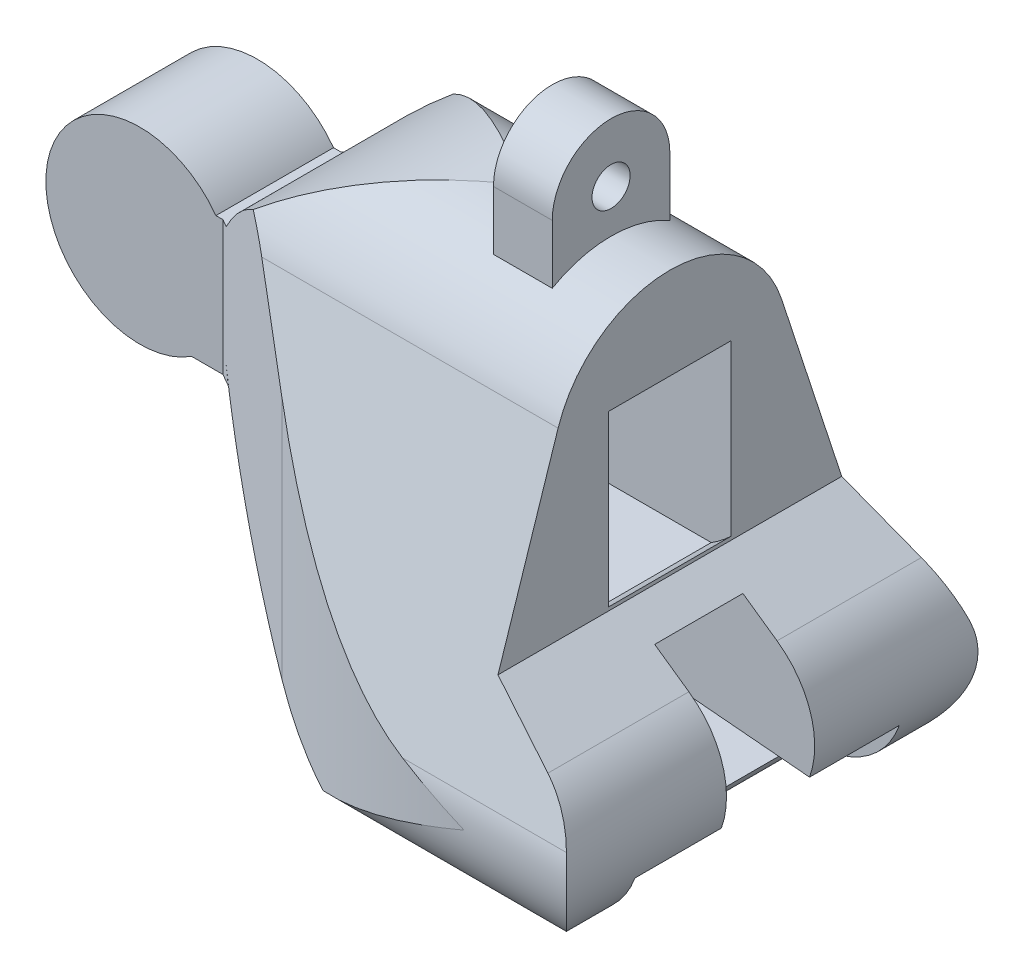
from build123d import *

# Parameters (mm, degrees)
BOSS_EXTRUDE1_DEPTH      = 6.35
BOSS_EXTRUDE2_START      = -7.9375
BOSS_EXTRUDE2_DEPTH      = 22.225
CUT_EXTRUDE1_DEPTH       = 51.557144521
CUT_EXTRUDE2_START       = -7.9375
CUT_EXTRUDE2_DEPTH       = 25.24
CUT_EXTRUDE7_DEPTH       = 10
CUT_EXTRUDE7_DEPTH_BACK  = 19.05
CUT_EXTRUDE10_DEPTH      = 10.16
CUT_EXTRUDE10_DEPTH_BACK = 17.78
CUT_EXTRUDE8_START       = 0.127
CUT_EXTRUDE8_DEPTH       = 6.604
BOSS_EXTRUDE3_START      = -3.175
BOSS_EXTRUDE3_DEPTH      = 3.175
SKETCH14_W               = 1.0287
SKETCH14_H               = 3.176
SKETCH15_W               = 4.7625
SKETCH15_H               = 4.7625
CUT_EXTRUDE15_DEPTH      = 8.703074479
CUT_EXTRUDE16_START      = -3.175
SKETCH16_W               = 4.7625
SKETCH16_H               = 4.7625
CUT_EXTRUDE16_DEPTH      = 32.52405251
SKETCH18_W               = 1.0287
SKETCH18_H               = 3.176
CUT_EXTRUDE17_DEPTH      = 4.7625
BOSS_EXTRUDE5_REACH      = 39.621
BOSS_EXTRUDE6_DEPTH      = 6.35
BOSS_EXTRUDE8_REACH      = 39.621
CUT_EXTRUDE19_DEPTH      = 10.31875
CUT_EXTRUDE19_DEPTH_BACK = 3.96875


with BuildPart() as part:
    # Sketch2 → Boss-Extrude1 (new body)
    with BuildSketch(Plane.XY):
        with BuildLine():
            Line((4.487320853, -2.38125), (4.487320853, 2.38125))
            ThreePointArc((4.487320853, 2.38125), (-5.08, 0), (4.487320853, -2.38125))
        make_face()
    extrude(amount=BOSS_EXTRUDE1_DEPTH)


with BuildPart() as body_2:
    # Sketch3 → Boss-Extrude2 (new body)
    with BuildSketch(Plane.XY.offset(BOSS_EXTRUDE2_START)):
        Polygon((4.487320853, 9.525), (25.442320853, 9.525), (25.442320853, -4.7625), (41.312615578, -15.875), (25.442320853, -15.875), (4.487320853, -15.875), align=None)
    extrude(amount=BOSS_EXTRUDE2_DEPTH)

    # Sketch4 → Cut-Extrude1 (cut, through all)
    with BuildSketch(Plane(origin=(0, 9.525, 0), x_dir=(1, 0, 0), z_dir=(0, 1, 0))):
        with BuildLine():
            Line((4.487320853, -6.35), (11.994161802, -10.684076643))
            ThreePointArc((11.994161802, -10.684076643), (18.481041485, -13.371030185), (25.442320853, -14.2875))
            Line((25.442320853, -14.2875), (4.487320853, -14.2875))
            Line((4.487320853, -14.2875), (4.487320853, -6.35))
        make_face()
        with BuildLine():
            Line((4.487320853, 0), (11.994161802, 4.334076643))
            ThreePointArc((11.994161802, 4.334076643), (18.481041485, 7.021030185), (25.442320853, 7.9375))
            Line((25.442320853, 7.9375), (4.487320853, 7.9375))
            Line((4.487320853, 7.9375), (4.487320853, 0))
        make_face()
    extrude(amount=-CUT_EXTRUDE1_DEPTH, mode=Mode.SUBTRACT)

    # Sketch5 → Cut-Extrude2 (cut)
    with BuildSketch(Plane.XY.offset(CUT_EXTRUDE2_START)):
        with BuildLine():
            Line((4.487320853, -15.875), (4.487320853, -2.38125))
            Line((4.487320853, -2.38125), (4.836453379, -3.34048373))
            ThreePointArc((4.836453379, -3.34048373), (11.810966692, -12.429846444), (22.737597804, -15.875))
            Line((22.737597804, -15.875), (4.487320853, -15.875))
        make_face()
        with BuildLine():
            Line((4.487320853, 2.38125), (4.487320853, 9.525))
            Line((4.487320853, 9.525), (17.504820853, 9.525))
            ThreePointArc((17.504820853, 9.525), (10.080393765, 7.621692137), (4.487320853, 2.38125))
        make_face()
        with BuildLine():
            Line((26.207895332, -15.875), (41.312615578, -15.875))
            Line((41.312615578, -15.875), (28.93955311, -7.211288389))
            ThreePointArc((28.93955311, -7.211288389), (30.74997231, -12.54461137), (26.207895332, -15.875))
        make_face()
    extrude(amount=CUT_EXTRUDE2_DEPTH, mode=Mode.SUBTRACT)

    # Sketch7 → Cut-Extrude7 (cut, two sides: drawn at the far end of the back side and taken through both)
    with BuildSketch(Plane(origin=(25.442320853, 0, 0), x_dir=(0, 0, -1), z_dir=(1, 0, 0)).offset(-CUT_EXTRUDE7_DEPTH_BACK)):
        with BuildLine():
            ThreePointArc((-9.525, -15.875), (-12.892596049, -14.480096041), (-14.2875, -11.112499989))
            Line((-14.2875, -11.112499989), (-14.2875, -15.875))
            Line((-14.2875, -15.875), (-9.525, -15.875))
        make_face()
        with BuildLine():
            ThreePointArc((7.9375, -11.112499982), (6.542596052, -14.480096039), (3.175, -15.875))
            Line((3.175, -15.875), (7.9375, -15.875))
            Line((7.9375, -15.875), (7.9375, -11.112499982))
        make_face()
    extrude(amount=CUT_EXTRUDE7_DEPTH + CUT_EXTRUDE7_DEPTH_BACK, mode=Mode.SUBTRACT)

    # Sketch7<4> → Cut-Extrude10 (cut, two sides: drawn at the far end of the back side and taken through both)
    with BuildSketch(Plane(origin=(25.442320853, 0, 0), x_dir=(0, 0, -1), z_dir=(1, 0, 0)).offset(-CUT_EXTRUDE10_DEPTH_BACK)):
        with BuildLine():
            ThreePointArc((-9.209570672, 5.151475854), (-6.901384194, 8.316649622), (-3.175, 9.525))
            Line((-3.175, 9.525), (-14.2875, 9.525))
            Line((-14.2875, 9.525), (-14.2875, -4.7625))
            Line((-14.2875, -4.7625), (-12.456650698, -4.7625))
            Line((-12.456650698, -4.7625), (-9.209570672, 5.151475854))
        make_face()
        with BuildLine():
            Line((6.106650698, -4.7625), (7.9375, -4.7625))
            Line((7.9375, -4.7625), (7.9375, 9.525))
            Line((7.9375, 9.525), (-3.175, 9.525))
            ThreePointArc((-3.175, 9.525), (0.551384194, 8.316649622), (2.859570672, 5.151475854))
            Line((2.859570672, 5.151475854), (6.106650698, -4.7625))
        make_face()
        with BuildLine():
            ThreePointArc((7.700928004, -9.630143109), (7.877985134, -10.361942155), (7.9375, -11.112499982))
            Line((7.9375, -11.112499982), (7.9375, -4.7625))
            Line((7.9375, -4.7625), (6.106650698, -4.7625))
            Line((6.106650698, -4.7625), (7.700928004, -9.630143109))
        make_face()
        with BuildLine():
            Line((-14.050928004, -9.630143109), (-12.456650698, -4.7625))
            Line((-12.456650698, -4.7625), (-14.2875, -4.7625))
            Line((-14.2875, -4.7625), (-14.2875, -11.112499989))
            ThreePointArc((-14.2875, -11.112499989), (-14.227985135, -10.361942158), (-14.050928004, -9.630143109))
        make_face()
    extrude(amount=CUT_EXTRUDE10_DEPTH + CUT_EXTRUDE10_DEPTH_BACK, mode=Mode.SUBTRACT)

    # Sketch8 → Cut-Extrude8 (cut)
    with BuildSketch(Plane.XY.offset(6.35).offset(CUT_EXTRUDE8_START)):
        with BuildLine():
            Line((25.442320853, -4.572), (25.442320853, 4.572))
            ThreePointArc((25.442320853, 4.572), (24.931170577, 5.014670211), (24.375846843, 5.400477249))
            Line((24.375846843, 5.400477249), (17.695324263, 5.400477249))
            Line((17.695324263, 5.400477249), (17.695324263, -5.400477249))
            Line((17.695324263, -5.400477249), (24.375846843, -5.400477249))
            ThreePointArc((24.375846843, -5.400477249), (24.931170577, -5.014670211), (25.442320853, -4.572))
        make_face()
    extrude(amount=-CUT_EXTRUDE8_DEPTH, mode=Mode.SUBTRACT)

    # Sketch12 → Boss-Extrude3 (add)
    with BuildSketch(Plane(origin=(25.442320853, 0, 0), x_dir=(0, 0, -1), z_dir=(1, 0, 0)).offset(BOSS_EXTRUDE3_START)):
        with BuildLine():
            Line((-6.35, 8.674261314), (0, 8.674261314))
            Line((0, 8.674261314), (0, 11.849261314))
            ThreePointArc((0, 11.849261314), (-3.175, 15.024261314), (-6.35, 11.849261314))
            Line((-6.35, 11.849261314), (-6.35, 8.674261314))
        make_face()
    extrude(amount=-BOSS_EXTRUDE3_DEPTH)

    # Sketch14 → #1 Clearance Hole1 (revolve, cut)
    with BuildSketch(Plane(origin=(22.267320853, 11.849261314, 3.175), x_dir=(0, 0, -1), z_dir=(0, 1, 0))):
        with Locations((0.51435, 1.588)):
            Rectangle(SKETCH14_W, SKETCH14_H)
    revolve(axis=Axis((28.617320853, 11.849261314, 3.175), (-1, 0, 0)), mode=Mode.SUBTRACT)

    # Sketch15 → Cut-Extrude15 (cut)
    with BuildSketch(Plane(origin=(30.970395332, 0, 0), x_dir=(0, 0, -1), z_dir=(1, 0, 0))):
        with Locations((-3.262930867, -9.592538389)):
            Rectangle(SKETCH15_W, SKETCH15_H)
    extrude(amount=-CUT_EXTRUDE15_DEPTH, mode=Mode.SUBTRACT)

    # Sketch16 → Cut-Extrude16 (cut, through all)
    with BuildSketch(Plane(origin=(22.267320853, 0, 0), x_dir=(0, 0, -1), z_dir=(1, 0, 0)).offset(CUT_EXTRUDE16_START)):
        with Locations((-3.262930867, -9.592538389)):
            Rectangle(SKETCH16_W, SKETCH16_H)
    extrude(amount=-CUT_EXTRUDE16_DEPTH, mode=Mode.SUBTRACT)

    # Sketch18 → #1 Clearance Hole2 (revolve, cut)
    with BuildSketch(Plane(origin=(22.267320853, -9.592538389, 3.262930867), x_dir=(0, 0, -1), z_dir=(0, 1, 0))):
        with Locations((0.51435, 1.588)):
            Rectangle(SKETCH18_W, SKETCH18_H)
    revolve(axis=Axis((28.617320853, -9.592538389, 3.262930867), (-1, 0, 0)), mode=Mode.SUBTRACT)

    # Sketch19 → Cut-Extrude17 (cut)
    with BuildSketch(Plane.XY.offset(0.881680867)):
        with BuildLine():
            Line((19.092320853, -11.973788389), (13.48400503, -13.476532085))
            ThreePointArc((13.48400503, -13.476532085), (9.265001461, -10.293171657), (6.083027043, -6.07312266))
            Line((6.083027043, -6.07312266), (19.092320853, -7.211288389))
            Line((19.092320853, -7.211288389), (19.092320853, -11.973788389))
        make_face()
        with BuildLine():
            Line((22.267320853, -7.211288389), (27.092931392, -5.918269942))
            Line((27.092931392, -5.918269942), (28.93955311, -7.211288389))
            ThreePointArc((28.93955311, -7.211288389), (30.745098667, -9.665022145), (30.694106103, -12.711036568))
            Line((30.694106103, -12.711036568), (22.267320853, -11.973788389))
            Line((22.267320853, -11.973788389), (22.267320853, -7.211288389))
        make_face()
    extrude(amount=CUT_EXTRUDE17_DEPTH, mode=Mode.SUBTRACT)

    # Boss-Extrude5: up to this face of the body (flat: up to its plane)
    boss_extrude5_end = Plane(body_2.part.faces().sort_by_distance((8.620061627, -2.410659079, -2.386038999))[0])
    # Sketch21 → Boss-Extrude5 (add, up to the picked face)
    with BuildSketch(Plane(origin=(0, 0, 0), x_dir=(-1, 0, 0), z_dir=(0, 0, -1)), mode=Mode.PRIVATE) as boss_extrude5_sk1:
        with BuildLine():
            Line((-4.487320853, 2.38125), (-4.487320853, 2.993520531))
            Line((-4.487320853, 2.993520531), (-4.898044681, 2.993520531))
            ThreePointArc((-4.898044681, 2.993520531), (-4.689025867, 2.689838391), (-4.487320853, 2.38125))
        make_face()
    boss_extrude5_tool1 = split(extrude(boss_extrude5_sk1.sketch, amount=BOSS_EXTRUDE5_REACH, mode=Mode.PRIVATE), bisect_by=boss_extrude5_end, keep=Keep.BOTH, mode=Mode.PRIVATE)
    # Sketch21 → Boss-Extrude5 (add, up to the picked face)
    with BuildSketch(Plane(origin=(0, 0, 0), x_dir=(-1, 0, 0), z_dir=(0, 0, -1)), mode=Mode.PRIVATE) as boss_extrude5_sk2:
        Polygon((-4.487320853, -2.38125), (-5.166825139, -4.248172683), (-4.487320853, -4.248172683), align=None)
    boss_extrude5_tool2 = split(extrude(boss_extrude5_sk2.sketch, amount=BOSS_EXTRUDE5_REACH, mode=Mode.PRIVATE), bisect_by=boss_extrude5_end, keep=Keep.BOTH, mode=Mode.PRIVATE)

    add(part.part)  # Boss-Extrude5 merges part
    add(boss_extrude5_tool1.solids().sort_by(Axis((4.623055, 2.791201, 0), (0, 0, -1)))[0])
    add(boss_extrude5_tool2.solids().sort_by(Axis((4.713822, -3.625865, 0), (0, 0, -1)))[0])

    # Sketch21<3> → Boss-Extrude6 (add)
    with BuildSketch(Plane(origin=(0, 0, 0), x_dir=(-1, 0, 0), z_dir=(0, 0, -1))):
        with BuildLine():
            Line((-5.166825139, -4.248172683), (-4.487320853, -2.38125))
            ThreePointArc((-4.487320853, -2.38125), (-3.754344697, -3.42217707), (-2.785575139, -4.248172683))
            Line((-2.785575139, -4.248172683), (-5.166825139, -4.248172683))
        make_face()
        with BuildLine():
            Line((-4.104294681, 2.993520531), (-4.898044681, 2.993520531))
            ThreePointArc((-4.898044681, 2.993520531), (-4.689025867, 2.689838391), (-4.487320853, 2.38125))
            ThreePointArc((-4.487320853, 2.38125), (-4.306702123, 2.694200592), (-4.104294681, 2.993520531))
        make_face()
    extrude(amount=-BOSS_EXTRUDE6_DEPTH)

    # Boss-Extrude8: up to this face of the body (flat: up to its plane)
    boss_extrude8_end = Plane(body_2.part.faces().sort_by_distance((8.620061627, -2.410659079, 8.736038999))[0])
    # Sketch22 → Boss-Extrude8 (add, up to the picked face)
    with BuildSketch(Plane.XY.offset(6.35), mode=Mode.PRIVATE) as boss_extrude8_sk1:
        Polygon((4.487320853, 2.38125), (4.501169681, 2.993520531), (4.898044681, 2.993520531), align=None)
    boss_extrude8_tool1 = split(extrude(boss_extrude8_sk1.sketch, amount=BOSS_EXTRUDE8_REACH, mode=Mode.PRIVATE), bisect_by=boss_extrude8_end, keep=Keep.BOTH, mode=Mode.PRIVATE)
    # Sketch22 → Boss-Extrude8 (add, up to the picked face)
    with BuildSketch(Plane.XY.offset(6.35), mode=Mode.PRIVATE) as boss_extrude8_sk2:
        Polygon((4.487320853, -2.38125), (4.487320853, -4.248172683), (5.166825139, -4.248172683), align=None)
    boss_extrude8_tool2 = split(extrude(boss_extrude8_sk2.sketch, amount=BOSS_EXTRUDE8_REACH, mode=Mode.PRIVATE), bisect_by=boss_extrude8_end, keep=Keep.BOTH, mode=Mode.PRIVATE)
    add(boss_extrude8_tool1.solids().sort_by(Axis((4.628845, 2.78943, 6.35), (0, 0, 1)))[0])
    add(boss_extrude8_tool2.solids().sort_by(Axis((4.713822, -3.625865, 6.35), (0, 0, 1)))[0])

    # Sketch28 → Cut-Extrude19 (cut, two sides: drawn at the far end of the back side and taken through both)
    with BuildSketch(Plane.XY.offset(-CUT_EXTRUDE19_DEPTH_BACK)):
        with BuildLine():
            Line((29.030898019, -12.565524716), (30.694106103, -12.711036568))
            ThreePointArc((30.694106103, -12.711036568), (28.952742854, -15.004442745), (26.207895332, -15.875))
            Line((26.207895332, -15.875), (22.737597804, -15.875))
            ThreePointArc((22.737597804, -15.875), (19.409236601, -15.581985677), (16.183264637, -14.711956609))
            ThreePointArc((16.183264637, -14.711956609), (14.809533786, -14.146902347), (13.48400503, -13.476532085))
            Line((13.48400503, -13.476532085), (15.808154767, -12.85377804))
            ThreePointArc((15.808154767, -12.85377804), (16.266196274, -13.044120459), (16.729459067, -13.221376891))
            ThreePointArc((16.729459067, -13.221376891), (19.686600035, -14.018903538), (22.737597804, -14.2875))
            Line((22.737597804, -14.2875), (26.207895332, -14.2875))
            ThreePointArc((26.207895332, -14.2875), (27.861266362, -13.823033017), (29.030898019, -12.565524716))
        make_face()
    extrude(amount=CUT_EXTRUDE19_DEPTH + CUT_EXTRUDE19_DEPTH_BACK, mode=Mode.SUBTRACT)


solid = body_2.part
